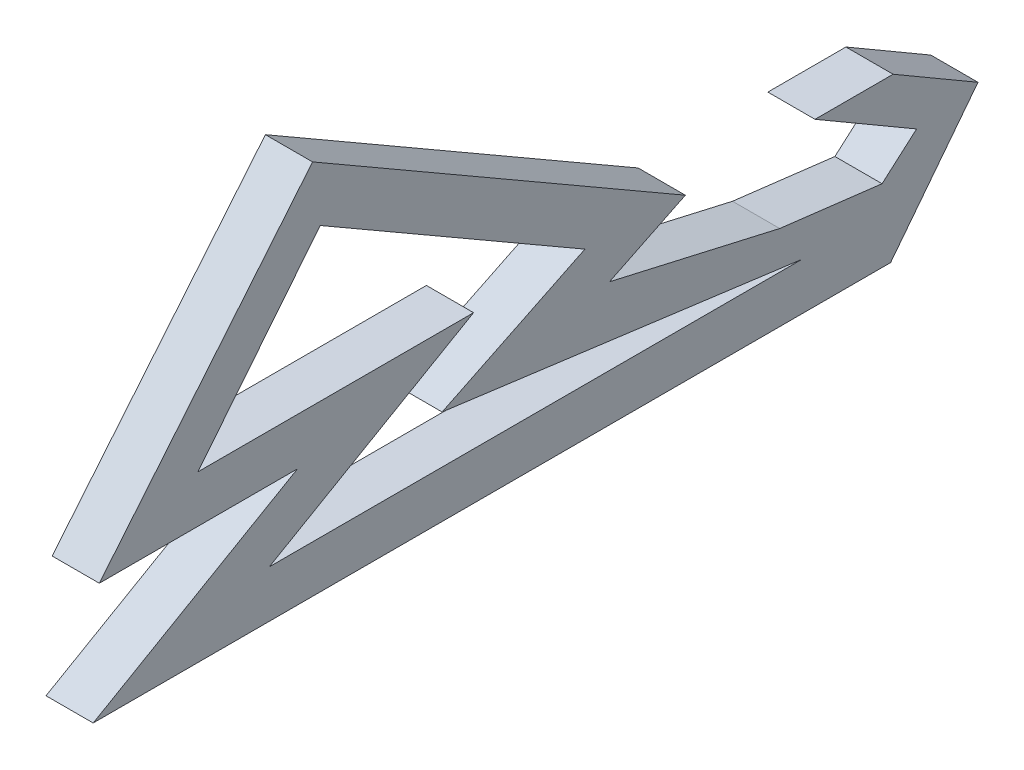
from build123d import *

# Parameters (mm, degrees)
BOSS_EXTRUDE1_DEPTH = 10


with BuildPart() as part:
    # Sketch1 → Boss-Extrude1 (new body)
    with BuildSketch(Plane(origin=(0, 0, 0), x_dir=(0, 0, -1), z_dir=(1, 0, 0))):
        Polygon((-84.5, 0), (84.5, 0), (103.022719545, 23.837300471), (85.030260907, 34.310612808), (68.481056011, 34.310612808), (90.006488303, 21.780775717), (82.690523765, 15.385421213), (60.999669369, 18.014714385), (24.911453349, 26.273949517), (41.001886779, 34.121778265), (-38.005922344, 79.73695813), (-83.198729811, 25), (-41.198729811, 25), align=None)
        Polygon((-47.179491924, 10), (-7.44944599, 10), (29.988283091, 10), (65.756507922, 10), (-10.545839316, 20.106291787), (19.714317813, 34.865156554), (1.503401285, 45.379234114), (-36.387555456, 67.255588188), (-62.314964122, 35), (-3.878221735, 35), (-18.992184521, 26.273949517), align=None, mode=Mode.SUBTRACT)
    extrude(amount=BOSS_EXTRUDE1_DEPTH)


solid = part.part
